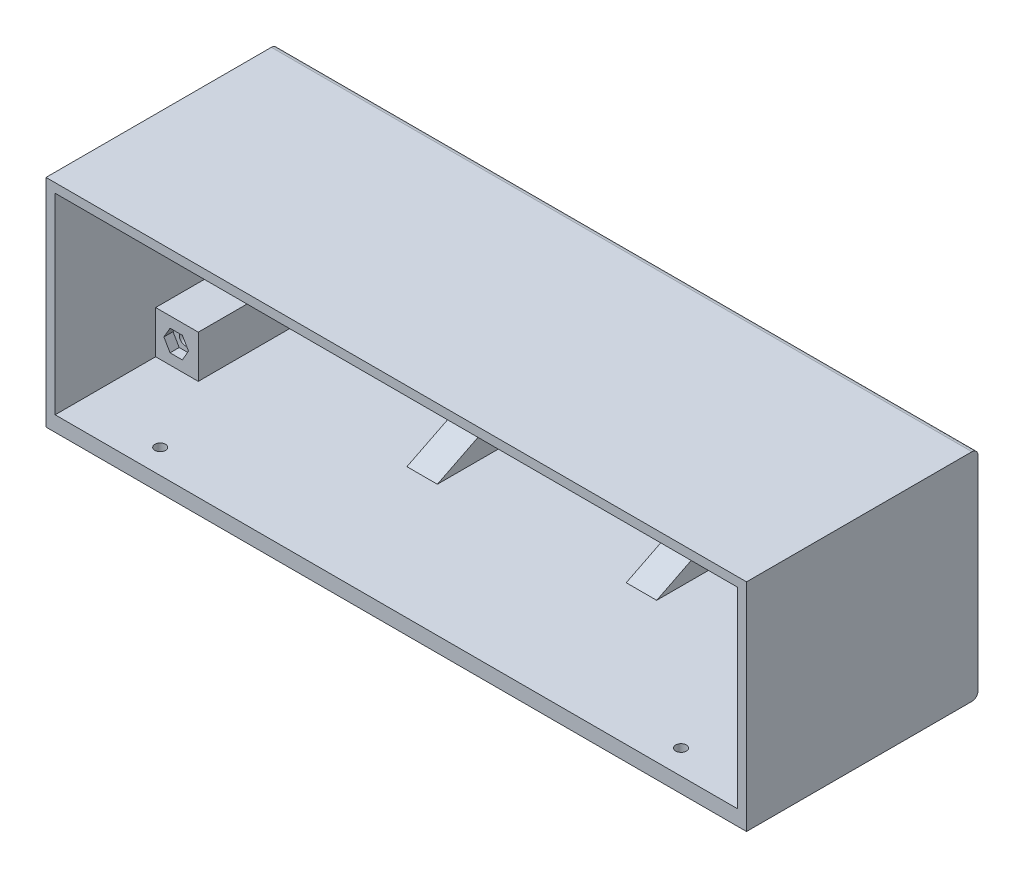
from build123d import *

# Parameters (mm, degrees)
SKETCH_1_W           = 224
SKETCH_1_H           = 63
EXTRUDE_6_DEPTH      = 3
SKETCH_1_3_W         = 230
SKETCH_1_3_H         = 69
SKETCH_1_3_W_2       = 224
SKETCH_1_3_H_2       = 63
EXTRUDE_1_DEPTH      = 76
SKETCH_6_W           = 23.5
SKETCH_6_H           = 35
SKETCH_6_W_2         = 24
CUT_EXTRUDE_1_DEPTH  = 4
SKETCH_8_W           = 14
SKETCH_8_H           = 14
EXTRUDE_8_DEPTH      = 40
SKETCH_11_R          = 2
CUT_EXTRUDE_2_DEPTH  = 10
CUT_EXTRUDE_4_DEPTH  = 3
SKETCH_14_W          = 14
SKETCH_14_H          = 14
EXTRUDE_9_DEPTH      = 44.5
SKETCH_15_R          = 2
CUT_EXTRUDE_5_DEPTH  = 13
CUT_EXTRUDE_11_DEPTH = 6
EXTRUDE_10_DEPTH     = 5
EXTRUDE_11_DEPTH     = 5
SKETCH_30_W          = 230
SKETCH_30_H          = 2
EXTRUDE_13_DEPTH     = 76
FILLET_3_R           = 2
SKETCH_31_R          = 2.75
CUT_EXTRUDE_13_DEPTH = 2.5
SKETCH_28_R          = 1.75
CUT_EXTRUDE_14_DEPTH = 2.5


with BuildPart() as part:
    # 草图1 → 凸台-拉伸6 (new body)
    with BuildSketch(Plane.XY):
        Rectangle(SKETCH_1_W, SKETCH_1_H)
    extrude(amount=EXTRUDE_6_DEPTH)

    # 草图1<3> → 拉伸-薄壁1 (add)
    with BuildSketch(Plane.XY):
        Rectangle(SKETCH_1_3_W, SKETCH_1_3_H)
        Rectangle(SKETCH_1_3_W_2, SKETCH_1_3_H_2, mode=Mode.SUBTRACT)
    extrude(amount=EXTRUDE_1_DEPTH)

    # 草图6 → 切除-拉伸1 (cut)
    with BuildSketch(Plane(origin=(0, 0, 0), x_dir=(-1, 0, 0), z_dir=(0, 0, -1))):
        with Locations((-83.8, -6)):
            Rectangle(SKETCH_6_W, SKETCH_6_H)
        with Locations((-55.55, -7)):
            Rectangle(SKETCH_6_W_2, SKETCH_6_H)
        with Locations((-14.25, -7)):
            Rectangle(SKETCH_6_W_2, SKETCH_6_H)
        with Locations((14.25, -7)):
            Rectangle(SKETCH_6_W_2, SKETCH_6_H)
        with Locations((55.55, -7)):
            Rectangle(SKETCH_6_W_2, SKETCH_6_H)
        with Locations((83.8, -7)):
            Rectangle(SKETCH_6_W, SKETCH_6_H)
    extrude(amount=-CUT_EXTRUDE_1_DEPTH, mode=Mode.SUBTRACT)

    # 草图8 → 凸台-拉伸8 (add)
    with BuildSketch(Plane.XY.offset(3)):
        with Locations((-105, 24.5)):
            Rectangle(SKETCH_8_W, SKETCH_8_H)
        with Locations((-105, -24.5)):
            Rectangle(SKETCH_8_W, SKETCH_8_H)
    extrude(amount=EXTRUDE_8_DEPTH)

    # 草图11 → 切除-拉伸2 (cut)
    with BuildSketch(Plane.XY.offset(43)):
        with Locations((-105.25, 24.51)):
            Circle(SKETCH_11_R)
        with Locations((-105.25, -24.51)):
            Circle(SKETCH_11_R)
    extrude(amount=-CUT_EXTRUDE_2_DEPTH, mode=Mode.SUBTRACT)

    # 草图12<2> → 切除-拉伸4 (cut)
    with BuildSketch(Plane.XY.offset(43)):
        Polygon((-107.270725942, 28.01), (-109.291451884, 24.51), (-107.270725942, 21.01), (-103.229274058, 21.01), (-101.208548116, 24.51), (-103.229274058, 28.01), align=None)
        Polygon((-101.208548116, -24.51), (-103.229274058, -21.01), (-107.270725942, -21.01), (-109.291451884, -24.51), (-107.270725942, -28.01), (-103.229274058, -28.01), align=None)
    extrude(amount=-CUT_EXTRUDE_4_DEPTH, mode=Mode.SUBTRACT)

    # 草图14 → 凸台-拉伸9 (add)
    with BuildSketch(Plane(origin=(0, 0, 0), x_dir=(-1, 0, 0), z_dir=(0, 0, -1))):
        with Locations((-105, 24.5)):
            Rectangle(SKETCH_14_W, SKETCH_14_H)
        with Locations((-105, -24.5)):
            Rectangle(SKETCH_14_W, SKETCH_14_H)
    extrude(amount=-EXTRUDE_9_DEPTH)

    # 草图15 → 切除-拉伸5 (cut)
    with BuildSketch(Plane.XY.offset(44.5)):
        with Locations((105.25, 24.514472103)):
            Circle(SKETCH_15_R)
        with Locations((105.25, -24.51)):
            Circle(SKETCH_15_R)
    extrude(amount=-CUT_EXTRUDE_5_DEPTH, mode=Mode.SUBTRACT)

    # 草图16 → 切除-拉伸11 (cut)
    with BuildSketch(Plane.XY.offset(44.5)):
        Polygon((103.229274058, 21.014472103), (107.270725942, 21.014472103), (109.291451884, 24.514472103), (107.270725942, 28.014472103), (103.229274058, 28.014472103), (101.208548116, 24.514472103), align=None)
        Polygon((103.229274058, -28.01), (107.270725942, -28.01), (109.291451884, -24.51), (107.270725942, -21.01), (103.229274058, -21.01), (101.208548116, -24.51), align=None)
    extrude(amount=-CUT_EXTRUDE_11_DEPTH, mode=Mode.SUBTRACT)

    # 草图21 → 凸台-拉伸10 (add, symmetric)
    with BuildSketch(Plane.ZY.offset(34.5)):
        Polygon((3, 31.5), (33, 31.5), (3, 16.5), align=None)
        Polygon((3, -16.5), (3, -31.5), (33, -31.5), align=None)
    extrude(amount=EXTRUDE_10_DEPTH, both=True)

    # 草图22 → 凸台-拉伸11 (add, symmetric)
    with BuildSketch(Plane(origin=(34.5, 0, 0), x_dir=(0, 0, -1), z_dir=(1, 0, 0))):
        Polygon((-3, 31.5), (-3, 16.5), (-33, 31.5), align=None)
        Polygon((0, -16.5), (0, -31.5), (-30, -31.5), align=None)
    extrude(amount=EXTRUDE_11_DEPTH, both=True)

    # 草图30 → 凸台-拉伸13 (add)
    with BuildSketch(Plane(origin=(0, 0, 0), x_dir=(-1, 0, 0), z_dir=(0, 0, -1))):
        with Locations((0, -35.5)):
            Rectangle(SKETCH_30_W, SKETCH_30_H)
    extrude(amount=-EXTRUDE_13_DEPTH)

    # 圆角3
    fillet_3_edges = [part.edges().sort_by_distance(p)[0] for p in [
        (0, 34.5, 0),
        (0, -36.5, 0),
    ]]
    fillet(fillet_3_edges, radius=FILLET_3_R)

    # 草图31 → 切除-拉伸13 (cut)
    with BuildSketch(Plane.XZ.offset(36.5)):
        with Locations((-85.5, 68)):
            Circle(SKETCH_31_R)
        with Locations((85.5, 68)):
            Circle(SKETCH_31_R)
    extrude(amount=-CUT_EXTRUDE_13_DEPTH, mode=Mode.SUBTRACT)

    # 草图28 → 切除-拉伸14 (cut)
    with BuildSketch(Plane(origin=(0, -31.5, 0), x_dir=(1, 0, 0), z_dir=(0, 1, 0))):
        with Locations((85.5, -68)):
            Circle(SKETCH_28_R)
        with Locations((-85.5, -68)):
            Circle(SKETCH_28_R)
    extrude(amount=-CUT_EXTRUDE_14_DEPTH, mode=Mode.SUBTRACT)


solid = part.part
